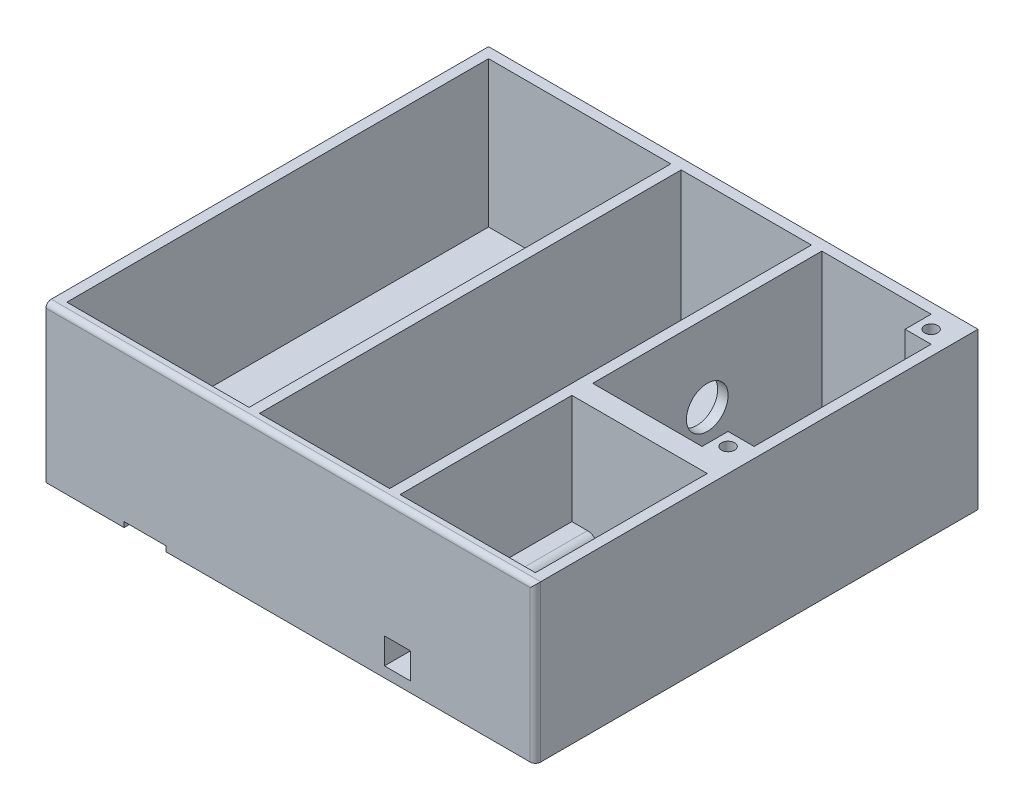
from build123d import *

# Parameters (mm, degrees)
SKETCH1_W           = 94
SKETCH1_H           = 85
BOSS_EXTRUDE1_DEPTH = 30
SKETCH2_W           = 35
SKETCH2_H           = 81
SKETCH2_W_2         = 25
SKETCH2_W_3         = 26
SKETCH2_H_2         = 33
SKETCH2_H_3         = 44
CUT_EXTRUDE1_DEPTH  = 28
SKETCH3_R           = 0.5
CUT_EXTRUDE2_DEPTH  = 28
SKETCH4_W           = 8
SKETCH4_H           = 11.916957973
CUT_EXTRUDE3_DEPTH  = 1
SKETCH5_R           = 4
CUT_EXTRUDE4_DEPTH  = 2
SKETCH6_W           = 5
SKETCH6_H           = 5
BOSS_EXTRUDE3_DEPTH = 28
SKETCH7_R           = 1.25
CUT_EXTRUDE5_DEPTH  = 20
FILLET1_R           = 1
SKETCH9_W           = 5
SKETCH9_H           = 33
BOSS_EXTRUDE4_DEPTH = 7
SKETCH10_W          = 5
SKETCH10_H          = 5
CUT_EXTRUDE7_DEPTH  = 39
FILLET3_R           = 2


with BuildPart() as part:
    # Sketch1 → Boss-Extrude1 (new body)
    with BuildSketch(Plane(origin=(0, 0, 0), x_dir=(1, 0, 0), z_dir=(0, 1, 0))):
        Rectangle(SKETCH1_W, SKETCH1_H)
    extrude(amount=BOSS_EXTRUDE1_DEPTH)

    # Sketch2 → Cut-Extrude1 (cut)
    with BuildSketch(Plane(origin=(0, 30, 0), x_dir=(1, 0, 0), z_dir=(0, 1, 0))):
        with Locations((-27.5, 0)):
            Rectangle(SKETCH2_W, SKETCH2_H)
        with Locations((4.5, 0)):
            Rectangle(SKETCH2_W_2, SKETCH2_H)
        with Locations((32, -24)):
            Rectangle(SKETCH2_W_3, SKETCH2_H_2)
        with Locations((32, 18.5)):
            Rectangle(SKETCH2_W_3, SKETCH2_H_3)
    extrude(amount=-CUT_EXTRUDE1_DEPTH, mode=Mode.SUBTRACT)

    # Sketch3 → Cut-Extrude2 (cut)
    with BuildSketch(Plane(origin=(0, 2, 0), x_dir=(1, 0, 0), z_dir=(0, 1, 0))):
        with Locations(Location((-30, -32.583042027, 0), (0, 0, 270))):
            Circle(SKETCH3_R)
        with Locations(Location((-26, -32.583042027, 0), (0, 0, 270))):
            Circle(SKETCH3_R)
    extrude(amount=-CUT_EXTRUDE2_DEPTH, mode=Mode.SUBTRACT)

    # Sketch4 → Cut-Extrude3 (cut)
    with BuildSketch(Plane(origin=(0, 0, 0), x_dir=(-1, 0, 0), z_dir=(0, -1, 0))):
        with Locations((28, -36.541521014)):
            Rectangle(SKETCH4_W, SKETCH4_H)
    extrude(amount=-CUT_EXTRUDE3_DEPTH, mode=Mode.SUBTRACT)

    # Sketch5 → Cut-Extrude4 (cut)
    with BuildSketch(Plane(origin=(19, 0, 0), x_dir=(0, 0, -1), z_dir=(1, 0, 0))):
        with Locations((18.5, 15)):
            Circle(SKETCH5_R)
    extrude(amount=-CUT_EXTRUDE4_DEPTH, mode=Mode.SUBTRACT)

    # Sketch6 → Boss-Extrude3 (add)
    with BuildSketch(Plane(origin=(0, 2, 0), x_dir=(1, 0, 0), z_dir=(0, 1, 0))):
        with Locations((42.5, 38)):
            Rectangle(SKETCH6_W, SKETCH6_H)
        with Locations((42.5, -1)):
            Rectangle(SKETCH6_W, SKETCH6_H)
    extrude(amount=BOSS_EXTRUDE3_DEPTH)

    # Sketch7 → Cut-Extrude5 (cut)
    with BuildSketch(Plane(origin=(0, 30, 0), x_dir=(1, 0, 0), z_dir=(0, 1, 0))):
        with Locations(Location((42.5, 38, 0), (0, 0, 270))):
            Circle(SKETCH7_R)
        with Locations(Location((42.5, -1, 0), (0, 0, 270))):
            Circle(SKETCH7_R)
    extrude(amount=-CUT_EXTRUDE5_DEPTH, mode=Mode.SUBTRACT)

    # Fillet1
    fillet1_edges = [part.edges().sort_by_distance(p)[0] for p in [
        (0, 30, 42.5),
        (47, 15, 42.5),
    ]]
    fillet(fillet1_edges, radius=FILLET1_R)

    # Sketch9 → Boss-Extrude4 (add)
    with BuildSketch(Plane(origin=(0, 2, 0), x_dir=(1, 0, 0), z_dir=(0, 1, 0))):
        with Locations((21.5, -24)):
            Rectangle(SKETCH9_W, SKETCH9_H)
    extrude(amount=BOSS_EXTRUDE4_DEPTH)

    # Sketch10 → Cut-Extrude7 (cut)
    with BuildSketch(Plane.XY.offset(42.5)):
        with Locations((20.5, 4.5)):
            Rectangle(SKETCH10_W, SKETCH10_H)
    extrude(amount=-CUT_EXTRUDE7_DEPTH, mode=Mode.SUBTRACT)

    # Fillet3
    fillet3_edges = [part.edges().sort_by_distance(p)[0] for p in [
        (24, 9, 24),
    ]]
    fillet(fillet3_edges, radius=FILLET3_R)


solid = part.part
